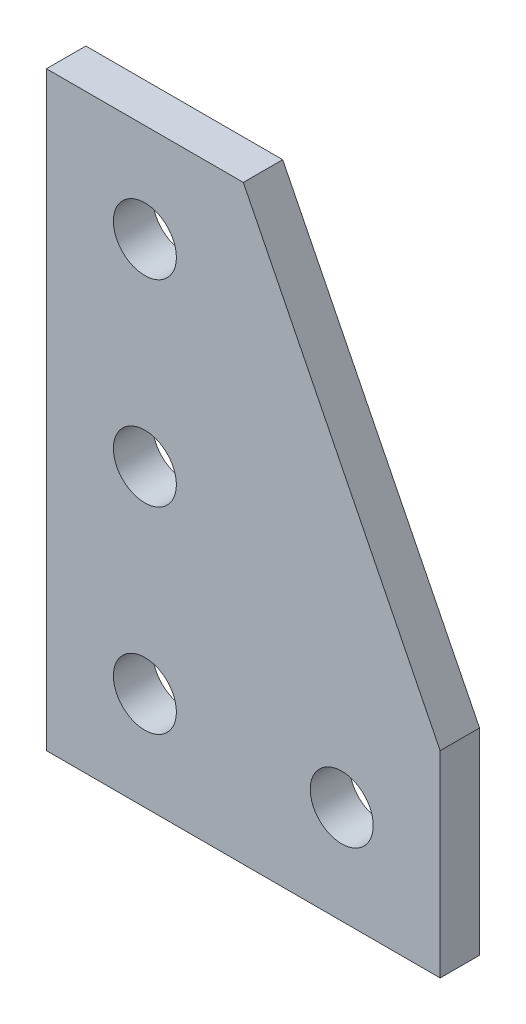
from build123d import *

# Parameters (mm, degrees)
SKETCH_1_R      = 1.6
EXTRUDE_1_DEPTH = 2


with BuildPart() as part:
    # ｽｹｯﾁ1 → ﾎﾞｽ - 押し出し1 (new body)
    with BuildSketch(Plane.XY):
        Polygon((0, 0), (0, 30), (10, 30), (20, 10), (20, 0), align=None)
        with Locations((5, 25)):
            Circle(SKETCH_1_R, mode=Mode.SUBTRACT)
        with Locations((5, 15)):
            Circle(SKETCH_1_R, mode=Mode.SUBTRACT)
        with Locations((5, 5)):
            Circle(SKETCH_1_R, mode=Mode.SUBTRACT)
        with Locations((15, 5)):
            Circle(SKETCH_1_R, mode=Mode.SUBTRACT)
    extrude(amount=EXTRUDE_1_DEPTH)


solid = part.part
